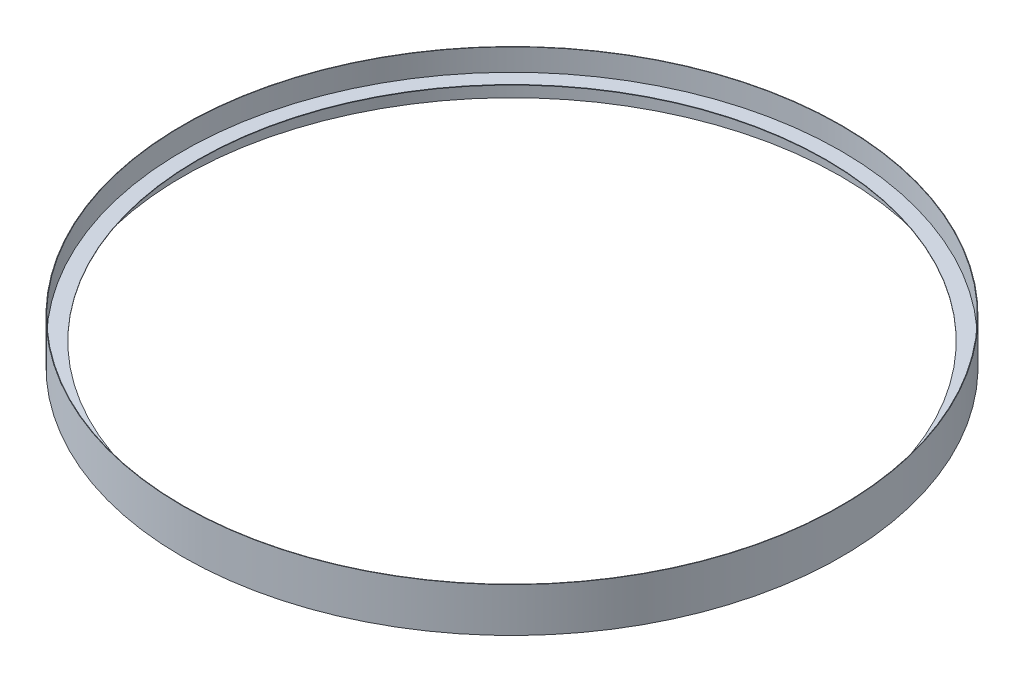
from build123d import *


with BuildPart() as part:
    # Эскиз1 → Повернуть1 (revolve)
    with BuildSketch(Plane.XY, mode=Mode.PRIVATE) as revolve_1_sk:
        Polygon((1493, 102), (1495, 102), (1495, -98), (1493, -98), (1493, 0), (1425, 0), (1425, 2), (1493, 2), align=None)
    revolve(revolve_1_sk.sketch.rotate(Axis((0, 0, 0), (0, 1, 0)), 90), axis=Axis((0, 0, 0), (0, 1, 0)))


solid = part.part
